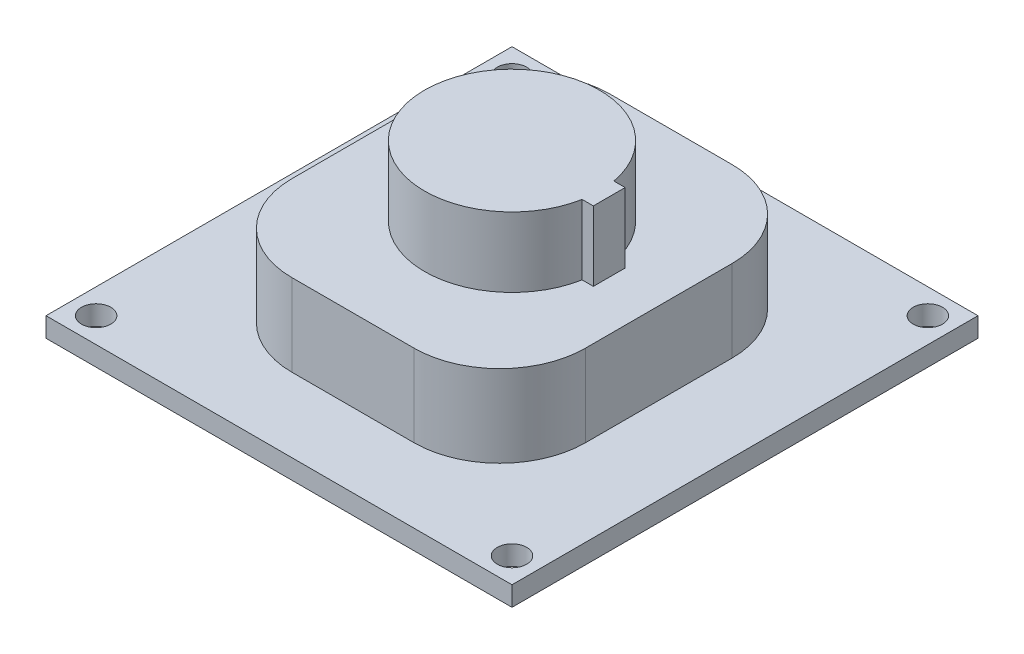
from build123d import *

# Parameters (mm, degrees)
SKETCH1_W           = 38.1
SKETCH1_H           = 38.1
SKETCH1_R           = 1.2
BOSS_EXTRUDE1_DEPTH = 1.6
BOSS_EXTRUDE2_DEPTH = 6.7
BOSS_EXTRUDE3_DEPTH = 5.7


with BuildPart() as part:
    # Sketch1 → Boss-Extrude1 (new body)
    with BuildSketch(Plane(origin=(0, 0, 0), x_dir=(1, 0, 0), z_dir=(0, 1, 0))):
        Rectangle(SKETCH1_W, SKETCH1_H)
        with Locations(Location((-17, 17, 0), (0, 0, 270))):
            Circle(SKETCH1_R, mode=Mode.SUBTRACT)
        with Locations(Location((17, 17, 0), (0, 0, 270))):
            Circle(SKETCH1_R, mode=Mode.SUBTRACT)
        with Locations(Location((17, -17, 0), (0, 0, 270))):
            Circle(SKETCH1_R, mode=Mode.SUBTRACT)
        with Locations(Location((-17, -17, 0), (0, 0, 270))):
            Circle(SKETCH1_R, mode=Mode.SUBTRACT)
    extrude(amount=BOSS_EXTRUDE1_DEPTH)

    # Sketch2 → Boss-Extrude2 (add)
    with BuildSketch(Plane(origin=(0, 1.6, 0), x_dir=(1, 0, 0), z_dir=(0, 1, 0))):
        with BuildLine():
            Line((-5, 13), (5, 13))
            ThreePointArc((5, 13), (9.949747468, 10.949747468), (12, 6))
            Line((12, 6), (12, -6))
            ThreePointArc((12, -6), (9.949747468, -10.949747468), (5, -13))
            Line((5, -13), (-5, -13))
            ThreePointArc((-5, -13), (-9.949747468, -10.949747468), (-12, -6))
            Line((-12, -6), (-12, 6))
            ThreePointArc((-12, 6), (-9.949747468, 10.949747468), (-5, 13))
        make_face()
    extrude(amount=BOSS_EXTRUDE2_DEPTH)

    # Sketch3 → Boss-Extrude3 (add)
    with BuildSketch(Plane(origin=(0, 8.3, 0), x_dir=(1, 0, 0), z_dir=(0, 1, 0))):
        with BuildLine():
            Line((7.030824987, 1.3), (7.95, 1.3))
            Line((7.95, 1.3), (7.95, -1.3))
            Line((7.95, -1.3), (7.030824987, -1.3))
            ThreePointArc((7.030824987, -1.3), (-7.15, 0), (7.030824987, 1.3))
        make_face()
    extrude(amount=BOSS_EXTRUDE3_DEPTH)


solid = part.part
